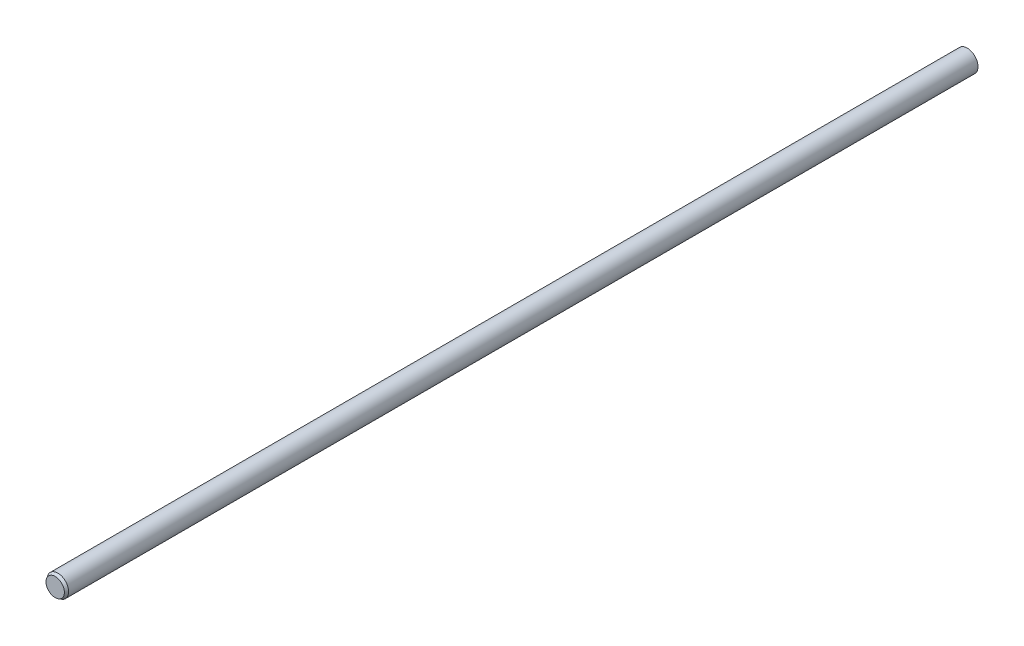
from build123d import *
from OCP.BRepFilletAPI import BRepFilletAPI_MakeChamfer

# Parameters (mm, degrees)
SKETCH1_R           = 4
BOSS_EXTRUDE1_DEPTH = 340
CHAMFER1_SIZE       = 1
CHAMFER1_SIZE2      = 0.577350269


with BuildPart() as part:
    # Sketch1 → Boss-Extrude1 (new body)
    with BuildSketch(Plane.XY):
        Circle(SKETCH1_R)
    extrude(amount=BOSS_EXTRUDE1_DEPTH)

    # Chamfer1: one chamfer whose edges measure the first distance from different faces: ONE call of the kernel's chamfer builder (chamfer() names one face for all edges)
    chamfer1_edges_1 = [part.edges().sort_by_distance(p)[0] for p in [
        (-4, 0, 0),
    ]]
    chamfer1_side_1 = [part.faces().sort_by_distance(p)[0] for p in [
        (0, 0, 0),
    ]]
    chamfer1_edges_2 = [part.edges().sort_by_distance(p)[0] for p in [
        (-4, 0, 340),
    ]]
    chamfer1_side_2 = [part.faces().sort_by_distance(p)[0] for p in [
        (-4, 0, 170),
    ]]
    chamfer1 = BRepFilletAPI_MakeChamfer(part.part.solid().wrapped)
    for e in chamfer1_edges_1:
        chamfer1.Add(CHAMFER1_SIZE, CHAMFER1_SIZE2, e.wrapped, chamfer1_side_1[0].wrapped)  # the first distance lies on this face
    for e in chamfer1_edges_2:
        chamfer1.Add(CHAMFER1_SIZE, CHAMFER1_SIZE2, e.wrapped, chamfer1_side_2[0].wrapped)  # the first distance lies on this face
    add(Compound.cast(chamfer1.Shape()), mode=Mode.REPLACE)


solid = part.part
